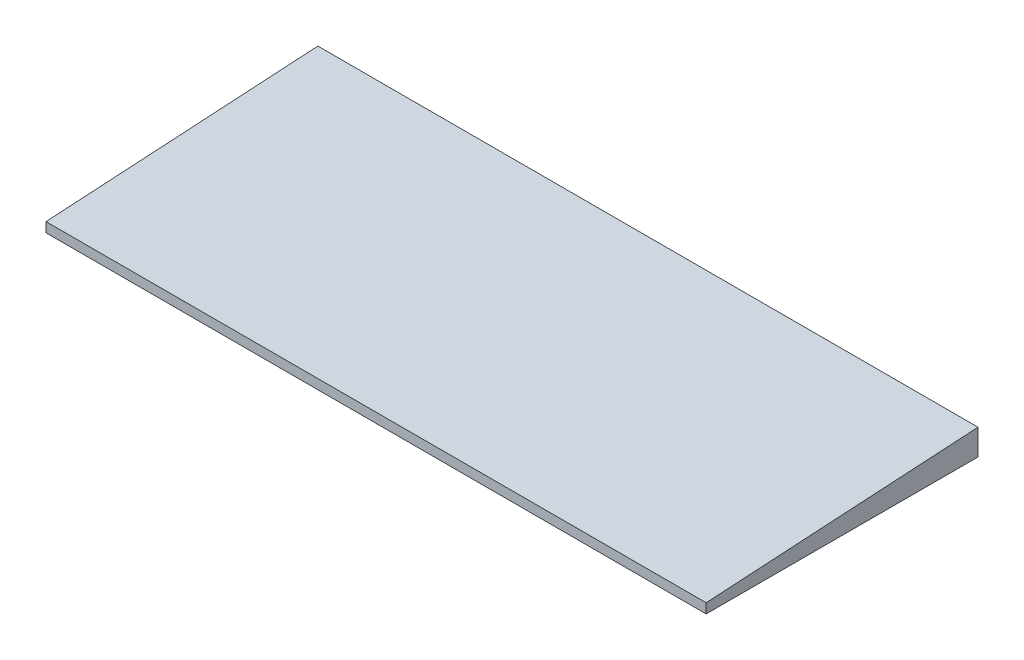
from build123d import *

# Parameters (mm, degrees)
AUFSATZ_LINEAR_AUSTRAGEN1_DEPTH = 279


with BuildPart() as part:
    # Skizze1 → Aufsatz-Linear austragen1 (new body)
    with BuildSketch(Plane(origin=(0, 0, 0), x_dir=(0, 0, -1), z_dir=(1, 0, 0))):
        Polygon((0, 0), (114.9, 0), (114.9, 10.9), (0, 4.1), align=None)
    extrude(amount=AUFSATZ_LINEAR_AUSTRAGEN1_DEPTH)


solid = part.part
